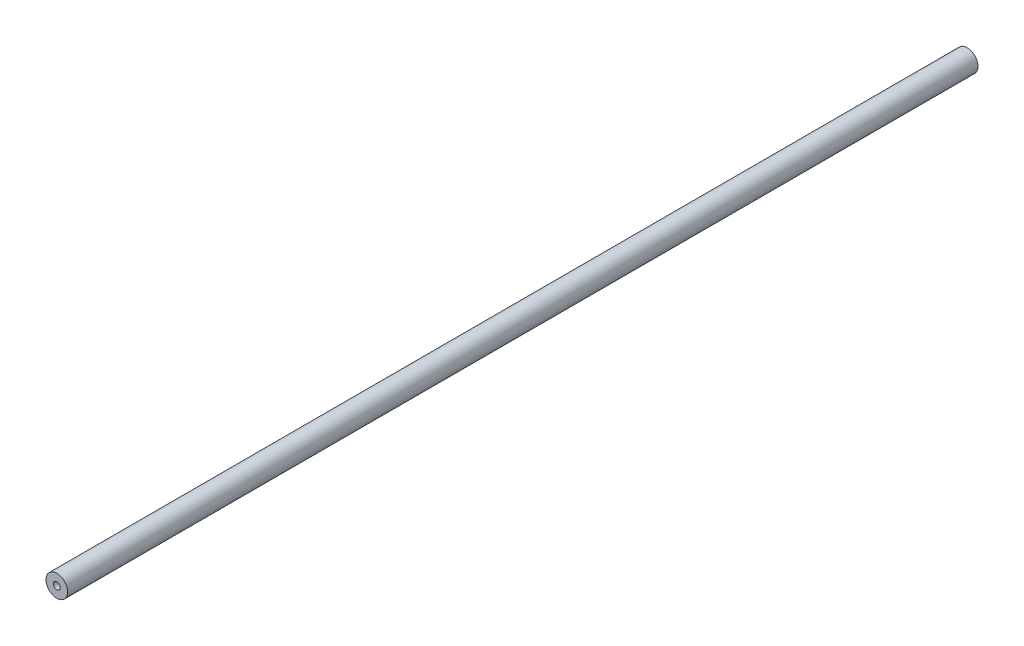
from build123d import *

# Parameters (mm, degrees)
SKETCH1_R                  = 6.35
BOSS_EXTRUDE1_DEPTH        = 533.4
F_10_32_TAPPED_HOLE1_D     = 4.0386
F_10_32_TAPPED_HOLE1_DEPTH = 13.716
F_10_32_TAPPED_HOLE1_TIP   = 1.213317848
F_10_32_TAPPED_HOLE2_D     = 4.0386
F_10_32_TAPPED_HOLE2_DEPTH = 13.716
F_10_32_TAPPED_HOLE2_TIP   = 1.213317848


with BuildPart() as part:
    # Sketch1 → Boss-Extrude1 (new body)
    with BuildSketch(Plane.XY):
        Circle(SKETCH1_R)
    extrude(amount=BOSS_EXTRUDE1_DEPTH)

    # #10-32 Tapped Hole1
    with Locations(Plane.XY.offset(533.4)):
        with Locations((0, 0)):
            Hole(F_10_32_TAPPED_HOLE1_D / 2, depth=F_10_32_TAPPED_HOLE1_DEPTH)
            with Locations((0, 0, -(F_10_32_TAPPED_HOLE1_DEPTH + F_10_32_TAPPED_HOLE1_TIP / 2))):  # 118° drill point
                Cone(0, F_10_32_TAPPED_HOLE1_D / 2, F_10_32_TAPPED_HOLE1_TIP, mode=Mode.SUBTRACT)

    # #10-32 Tapped Hole2
    with Locations(Plane(origin=(0, 0, 0), x_dir=(-1, 0, 0), z_dir=(0, 0, -1))):
        with Locations((0, 0)):
            Hole(F_10_32_TAPPED_HOLE2_D / 2, depth=F_10_32_TAPPED_HOLE2_DEPTH)
            with Locations((0, 0, -(F_10_32_TAPPED_HOLE2_DEPTH + F_10_32_TAPPED_HOLE2_TIP / 2))):  # 118° drill point
                Cone(0, F_10_32_TAPPED_HOLE2_D / 2, F_10_32_TAPPED_HOLE2_TIP, mode=Mode.SUBTRACT)


solid = part.part
